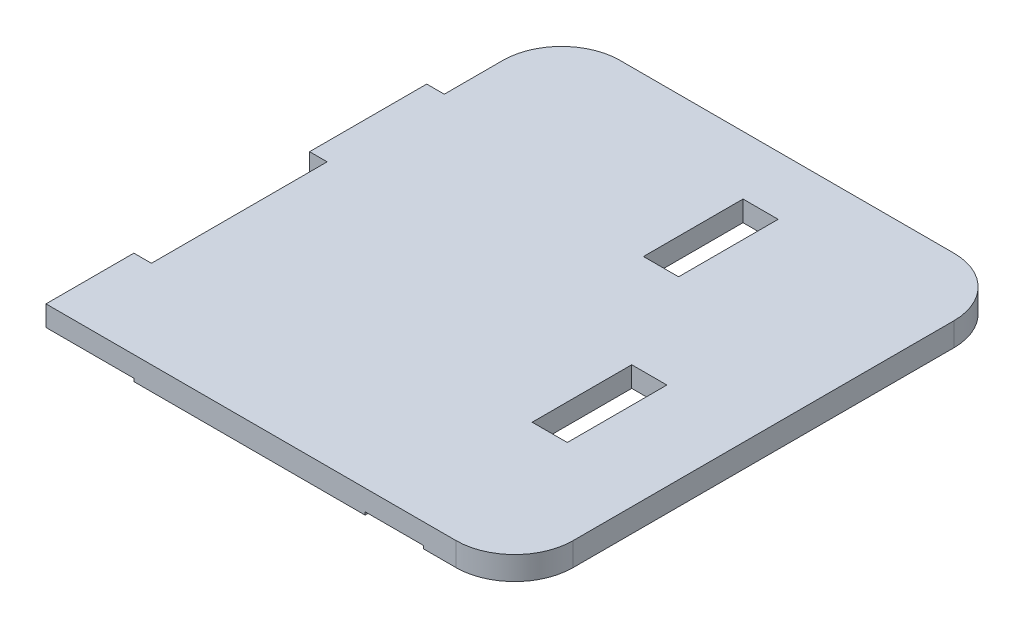
from build123d import *

# Parameters (mm, degrees)
SKETCH1_W           = 0.6
SKETCH1_H           = 1.7
BOSS_EXTRUDE1_DEPTH = 0.4
FILLET2_R           = 1
SKETCH2_W           = 1.5
SKETCH2_H           = 8.5
CUT_EXTRUDE1_DEPTH  = 0.05


with BuildPart() as part:
    # Sketch1 → Boss-Extrude1 (new body)
    with BuildSketch(Plane(origin=(0, 0, 0), x_dir=(1, 0, 0), z_dir=(0, 1, 0))):
        Polygon((0, 0), (8, 0), (8, 8.5), (0.3, 8.5), (0.3, 6.5), (0, 6.5), (0, 4.5), (0.3, 4.5), (0.3, 1.5), (0, 1.5), align=None)
        with Locations((4.7, 6.65)):
            Rectangle(SKETCH1_W, SKETCH1_H, mode=Mode.SUBTRACT)
        with Locations((6.2, 3.25)):
            Rectangle(SKETCH1_W, SKETCH1_H, mode=Mode.SUBTRACT)
    extrude(amount=BOSS_EXTRUDE1_DEPTH)

    # Fillet2
    fillet2_edges = [part.edges().sort_by_distance(p)[0] for p in [
        (0.3, 0.2, -8.5),
        (8, 0.2, -8.5),
        (8, 0.2, 0),
    ]]
    fillet(fillet2_edges, radius=FILLET2_R)

    # Sketch2 → Cut-Extrude1 (cut)
    with BuildSketch(Plane.XZ):
        with BuildLine():
            Line((6.448166538, -2.4), (6.448166538, -5.1))
            ThreePointArc((6.448166538, -5.1), (6.314670512, -5.458517669), (5.979203511, -5.642414377))
            Line((5.979203511, -5.642414377), (4.9, -5.8))
            Line((4.9, -5.8), (4.9, -8.5))
            ThreePointArc((4.9, -8.5), (4.4, -9), (3.9, -8.5))
            Line((3.9, -8.5), (3.9, -5.8))
            Line((3.9, -5.8), (3.9, -5.367707784))
            ThreePointArc((3.9, -5.367707784), (4.021765938, -5.040692502), (4.327755978, -4.872954511))
            Line((4.327755978, -4.872954511), (5.448166538, -4.709351823))
            Line((5.448166538, -4.709351823), (5.448166538, -2.4))
            Line((5.448166538, -2.4), (5.448166538, 0))
            Line((5.448166538, 0), (6.448166538, 0))
            Line((6.448166538, 0), (6.448166538, -2.4))
        make_face()
        with Locations((0.75, -4.25)):
            Rectangle(SKETCH2_W, SKETCH2_H)
    extrude(amount=-CUT_EXTRUDE1_DEPTH, mode=Mode.SUBTRACT)


solid = part.part
